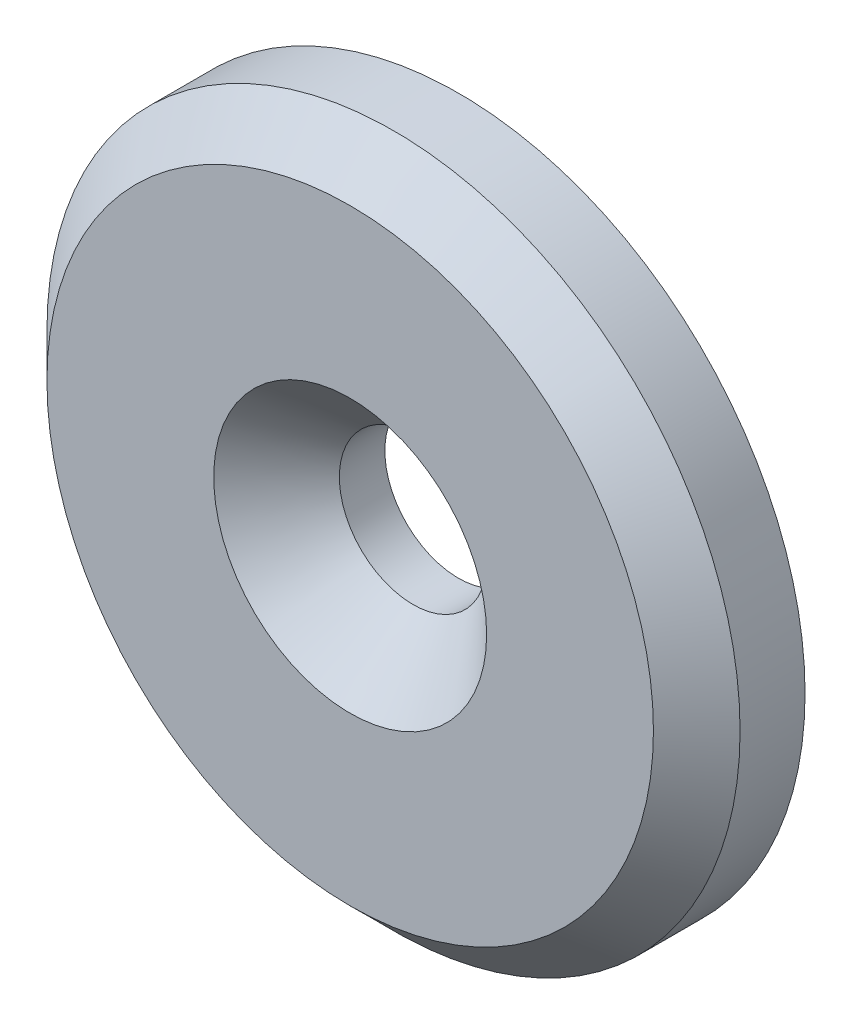
from build123d import *

# Parameters (mm, degrees)
SKETCH_1_R      = 8
EXTRUDE_1_DEPTH = 2.5
CHAMFER_1_SIZE  = 1


with BuildPart() as part:
    # Эскиз1 → Бобышка-Вытянуть1 (new body)
    with BuildSketch(Plane.XY):
        Circle(SKETCH_1_R)
    extrude(amount=EXTRUDE_1_DEPTH)

    # Фаска1
    chamfer_1_edges = [part.edges().sort_by_distance(p)[0] for p in [
        (-8, 0, 2.5),
    ]]
    chamfer(chamfer_1_edges, length=CHAMFER_1_SIZE)

    # Эскиз4 → Зенковка для винта с полупотайной головкой M31 (revolve, cut)
    with BuildSketch(Plane(origin=(0, 0, 2.5), x_dir=(0, -1, 0), z_dir=(1, 0, 0))):
        Polygon((0, 0), (0, 2.5), (1.7, 2.5), (1.7, 1.45), (3.15, 0), align=None)
    revolve(axis=Axis((0, 0, 8.85), (0, 0, -1)), mode=Mode.SUBTRACT)


solid = part.part
